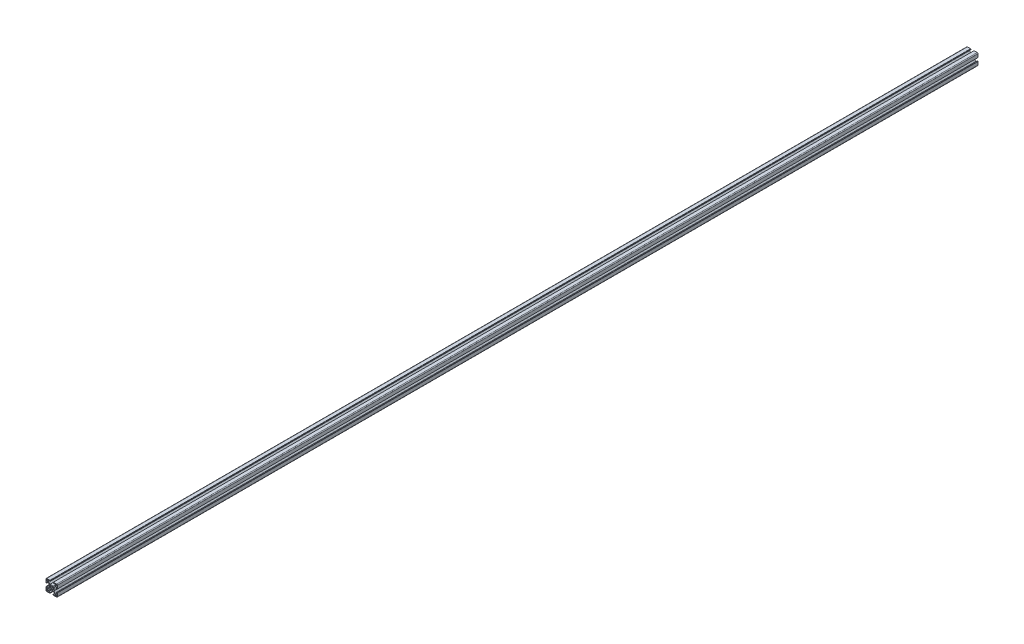
from build123d import *

# Parameters (mm, degrees)
SKETCH3_W           = 3.68
SKETCH3_H           = 3.68
BOSS_EXTRUDE1_DEPTH = 1219.2


with BuildPart() as part:
    # Sketch3 → Boss-Extrude1 (new, symmetric)
    with BuildSketch(Plane.XY):
        with BuildLine():
            Line((-4.203948776, 6), (0, 6))
            Line((0, 6), (4.203948776, 6))
            Line((4.203948776, 6), (8.2, 9.996051224))
            Line((8.2, 9.996051224), (8.2, 12.71))
            Line((8.2, 12.71), (4, 12.71))
            Line((4, 12.71), (4, 14.5))
            Line((4, 14.5), (4.5, 14.5))
            Line((4.5, 14.5), (4.5, 15))
            Line((4.5, 15), (12.968, 15))
            ThreePointArc((12.968, 15), (14.404840979, 14.404840979), (15, 12.968))
            Line((15, 12.968), (15, 4.5))
            Line((15, 4.5), (14.5, 4.5))
            Line((14.5, 4.5), (14.5, 4))
            Line((14.5, 4), (12.71, 4))
            Line((12.71, 4), (12.71, 8.2))
            Line((12.71, 8.2), (9.996051224, 8.2))
            Line((9.996051224, 8.2), (6, 4.203948776))
            Line((6, 4.203948776), (6, 0))
            Line((6, 0), (6, -4.203948776))
            Line((6, -4.203948776), (9.996051224, -8.2))
            Line((9.996051224, -8.2), (12.71, -8.2))
            Line((12.71, -8.2), (12.71, -4))
            Line((12.71, -4), (14.5, -4))
            Line((14.5, -4), (14.5, -4.5))
            Line((14.5, -4.5), (15, -4.5))
            Line((15, -4.5), (15, -12.968))
            ThreePointArc((15, -12.968), (14.404840979, -14.404840979), (12.968, -15))
            Line((12.968, -15), (4.5, -15))
            Line((4.5, -15), (4.5, -14.5))
            Line((4.5, -14.5), (4, -14.5))
            Line((4, -14.5), (4, -12.71))
            Line((4, -12.71), (8.2, -12.71))
            Line((8.2, -12.71), (8.2, -9.996051224))
            Line((8.2, -9.996051224), (4.203948776, -6))
            Line((4.203948776, -6), (0, -6))
            Line((0, -6), (-4.203948776, -6))
            Line((-4.203948776, -6), (-8.2, -9.996051224))
            Line((-8.2, -9.996051224), (-8.2, -12.71))
            Line((-8.2, -12.71), (-4, -12.71))
            Line((-4, -12.71), (-4, -14.5))
            Line((-4, -14.5), (-4.5, -14.5))
            Line((-4.5, -14.5), (-4.5, -15))
            Line((-4.5, -15), (-12.968, -15))
            ThreePointArc((-12.968, -15), (-14.404840979, -14.404840979), (-15, -12.968))
            Line((-15, -12.968), (-15, -4.5))
            Line((-15, -4.5), (-14.5, -4.5))
            Line((-14.5, -4.5), (-14.5, -4))
            Line((-14.5, -4), (-12.71, -4))
            Line((-12.71, -4), (-12.71, -8.2))
            Line((-12.71, -8.2), (-9.996051224, -8.2))
            Line((-9.996051224, -8.2), (-6, -4.203948776))
            Line((-6, -4.203948776), (-6, 0))
            Line((-6, 0), (-6, 4.203948776))
            Line((-6, 4.203948776), (-9.996051224, 8.2))
            Line((-9.996051224, 8.2), (-12.71, 8.2))
            Line((-12.71, 8.2), (-12.71, 4))
            Line((-12.71, 4), (-14.5, 4))
            Line((-14.5, 4), (-14.5, 4.5))
            Line((-14.5, 4.5), (-15, 4.5))
            Line((-15, 4.5), (-15, 12.968))
            ThreePointArc((-15, 12.968), (-14.404840979, 14.404840979), (-12.968, 15))
            Line((-12.968, 15), (-4.5, 15))
            Line((-4.5, 15), (-4.5, 14.5))
            Line((-4.5, 14.5), (-4, 14.5))
            Line((-4, 14.5), (-4, 12.71))
            Line((-4, 12.71), (-8.2, 12.71))
            Line((-8.2, 12.71), (-8.2, 9.996051224))
            Line((-8.2, 9.996051224), (-4.203948776, 6))
        make_face()
        with Locations((-11.63, 11.63)):
            Rectangle(SKETCH3_W, SKETCH3_H, mode=Mode.SUBTRACT)
        with BuildLine():
            Line((-3.143089642, 4.493663594), (-1.705676589, 3.056250541))
            ThreePointArc((-1.705676589, 3.056250541), (0, 3.5), (1.705676589, 3.056250541))
            Line((1.705676589, 3.056250541), (3.143089642, 4.493663594))
            Line((3.143089642, 4.493663594), (4.493663594, 3.143089642))
            Line((4.493663594, 3.143089642), (3.056250541, 1.705676589))
            ThreePointArc((3.056250541, 1.705676589), (3.5, 0), (3.056250541, -1.705676589))
            Line((3.056250541, -1.705676589), (4.493663594, -3.143089642))
            Line((4.493663594, -3.143089642), (3.143089642, -4.493663594))
            Line((3.143089642, -4.493663594), (1.705676589, -3.056250541))
            ThreePointArc((1.705676589, -3.056250541), (0, -3.5), (-1.705676589, -3.056250541))
            Line((-1.705676589, -3.056250541), (-3.143089642, -4.493663594))
            Line((-3.143089642, -4.493663594), (-4.493663594, -3.143089642))
            Line((-4.493663594, -3.143089642), (-3.056250541, -1.705676589))
            ThreePointArc((-3.056250541, -1.705676589), (-3.5, 0), (-3.056250541, 1.705676589))
            Line((-3.056250541, 1.705676589), (-4.493663594, 3.143089642))
            Line((-4.493663594, 3.143089642), (-3.143089642, 4.493663594))
        make_face(mode=Mode.SUBTRACT)
        with Locations((11.63, 11.63)):
            Rectangle(SKETCH3_W, SKETCH3_H, mode=Mode.SUBTRACT)
        with Locations((11.63, -11.63)):
            Rectangle(SKETCH3_W, SKETCH3_H, mode=Mode.SUBTRACT)
        with Locations((-11.63, -11.63)):
            Rectangle(SKETCH3_W, SKETCH3_H, mode=Mode.SUBTRACT)
    extrude(amount=BOSS_EXTRUDE1_DEPTH, both=True)


solid = part.part
